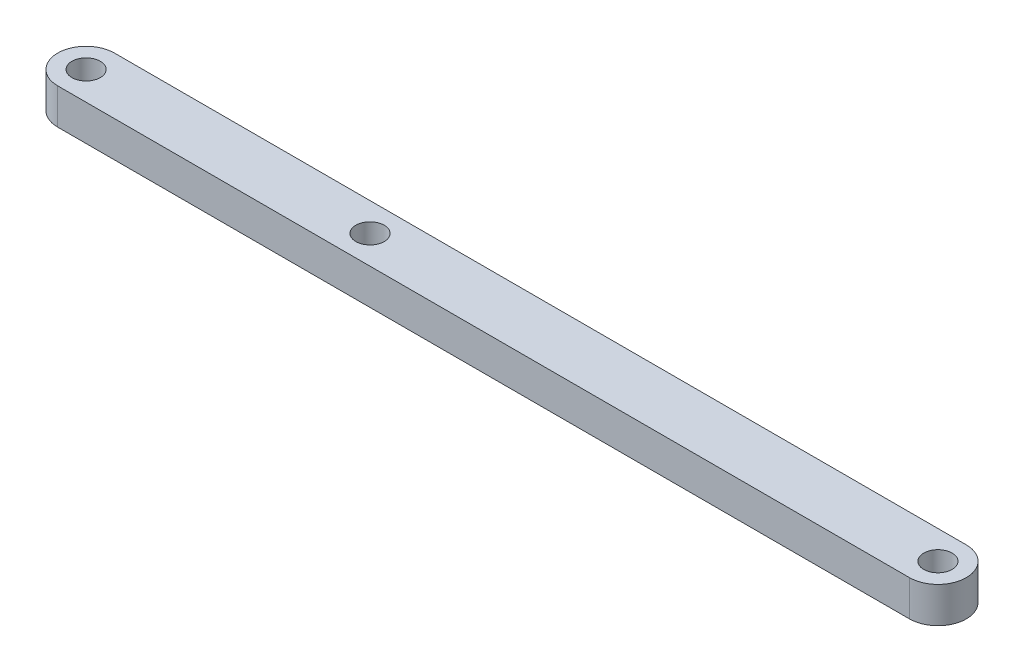
from build123d import *

# Parameters (mm, degrees)
SKETCH1_R           = 1.27
BOSS_EXTRUDE1_DEPTH = 3.2004


with BuildPart() as part:
    # Sketch1 → Boss-Extrude1 (new body)
    with BuildSketch(Plane(origin=(0, 0, 0), x_dir=(1, 0, 0), z_dir=(0, 1, 0))):
        with BuildLine():
            Line((-95.25, -2.54), (-19.05, -2.54))
            ThreePointArc((-19.05, -2.54), (-16.51, 0), (-19.05, 2.54))
            Line((-19.05, 2.54), (-95.25, 2.54))
            ThreePointArc((-95.25, 2.54), (-97.79, 0), (-95.25, -2.54))
        make_face()
        with Locations(Location((-95.25, 0, 0), (0, 0, 270))):
            Circle(SKETCH1_R, mode=Mode.SUBTRACT)
        with Locations(Location((-19.05, 0, 0), (0, 0, 270))):
            Circle(SKETCH1_R, mode=Mode.SUBTRACT)
        with Locations(Location((-69.85, 0, 0), (0, 0, 270))):
            Circle(SKETCH1_R, mode=Mode.SUBTRACT)
    extrude(amount=BOSS_EXTRUDE1_DEPTH)


solid = part.part
